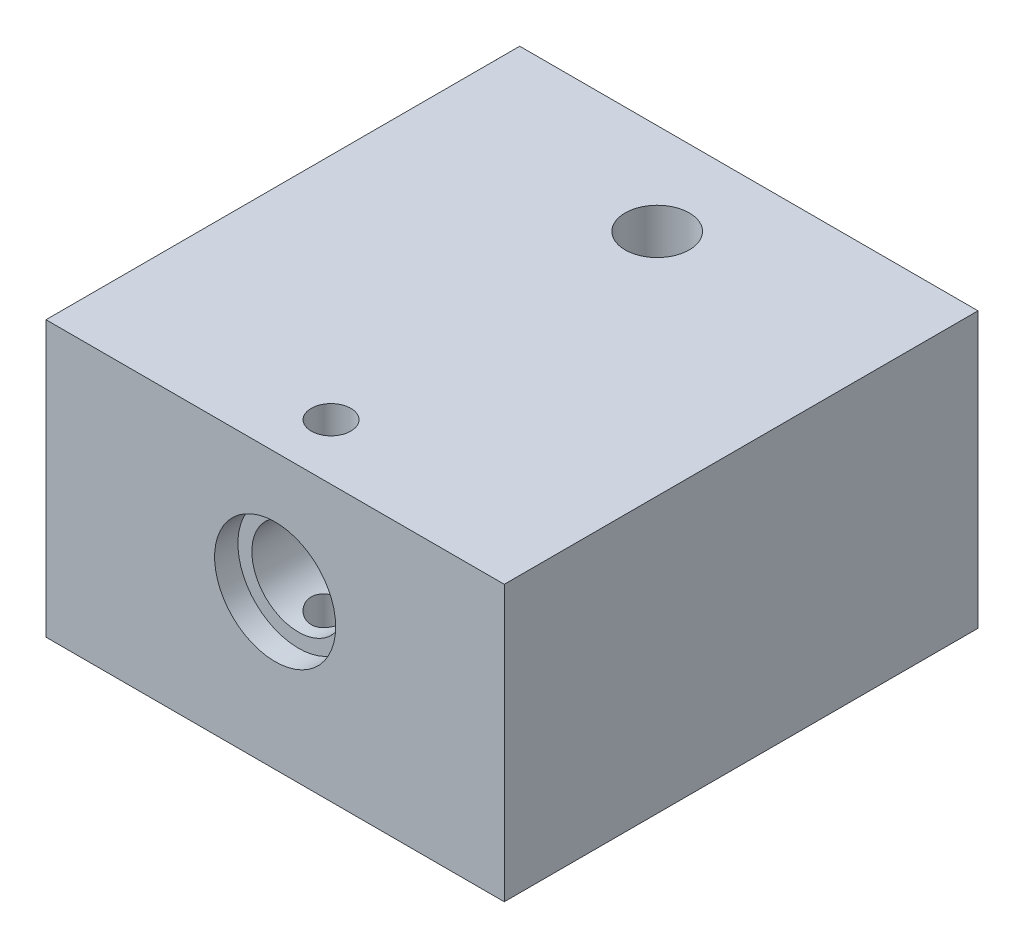
from build123d import *

# Parameters (mm, degrees)
SKETCH1_W           = 25
SKETCH1_H           = 5.842
BOSS_EXTRUDE1_DEPTH = 15
SKETCH5_R           = 2.54
CUT_EXTRUDE3_DEPTH  = 85.289149032
SKETCH7_R           = 3.302
CUT_EXTRUDE4_DEPTH  = 1.27
SKETCH10_R          = 1.0795
CUT_EXTRUDE7_DEPTH  = 102.459910937
SKETCH11_W          = 25
SKETCH11_H          = 15
BOSS_EXTRUDE2_DEPTH = 20
SKETCH12_R          = 1.75
CUT_EXTRUDE8_DEPTH  = 114.864732767


with BuildPart() as part:
    # Sketch1 → Boss-Extrude1 (new body)
    with BuildSketch(Plane(origin=(0, 0, 0), x_dir=(1, 0, 0), z_dir=(0, 1, 0))):
        with Locations((-70.237728278, 53.855595943)):
            Rectangle(SKETCH1_W, SKETCH1_H)
    extrude(amount=BOSS_EXTRUDE1_DEPTH)

    # Sketch5 → Cut-Extrude3 (cut, through all)
    with BuildSketch(Plane.XY.offset(-50.934595943)):
        with Locations((-70.237728278, 8.396)):
            Circle(SKETCH5_R)
    extrude(amount=-CUT_EXTRUDE3_DEPTH, mode=Mode.SUBTRACT)

    # Sketch7 → Cut-Extrude4 (cut)
    with BuildSketch(Plane.XY.offset(-50.934595943)):
        with Locations((-70.237728278, 8.396)):
            Circle(SKETCH7_R)
    extrude(amount=-CUT_EXTRUDE4_DEPTH, mode=Mode.SUBTRACT)

    # Sketch10 → Cut-Extrude7 (cut, through all)
    with BuildSketch(Plane(origin=(0, 15, 0), x_dir=(1, 0, 0), z_dir=(0, 1, 0))):
        with Locations(Location((-70.237728278, 53.982595943, 0), (0, 0, 270))):
            Circle(SKETCH10_R)
    extrude(amount=-CUT_EXTRUDE7_DEPTH, mode=Mode.SUBTRACT)

    # Sketch11 → Boss-Extrude2 (add)
    with BuildSketch(Plane(origin=(0, 0, -56.776595943), x_dir=(-1, 0, 0), z_dir=(0, 0, -1))):
        with Locations((70.237728278, 7.5)):
            Rectangle(SKETCH11_W, SKETCH11_H)
    extrude(amount=BOSS_EXTRUDE2_DEPTH)

    # Sketch12 → Cut-Extrude8 (cut, through all)
    with BuildSketch(Plane(origin=(0, 15, 0), x_dir=(1, 0, 0), z_dir=(0, 1, 0))):
        with Locations(Location((-70.237728278, 71.776595943, 0), (0, 0, 270))):
            Circle(SKETCH12_R)
    extrude(amount=-CUT_EXTRUDE8_DEPTH, mode=Mode.SUBTRACT)


solid = part.part
